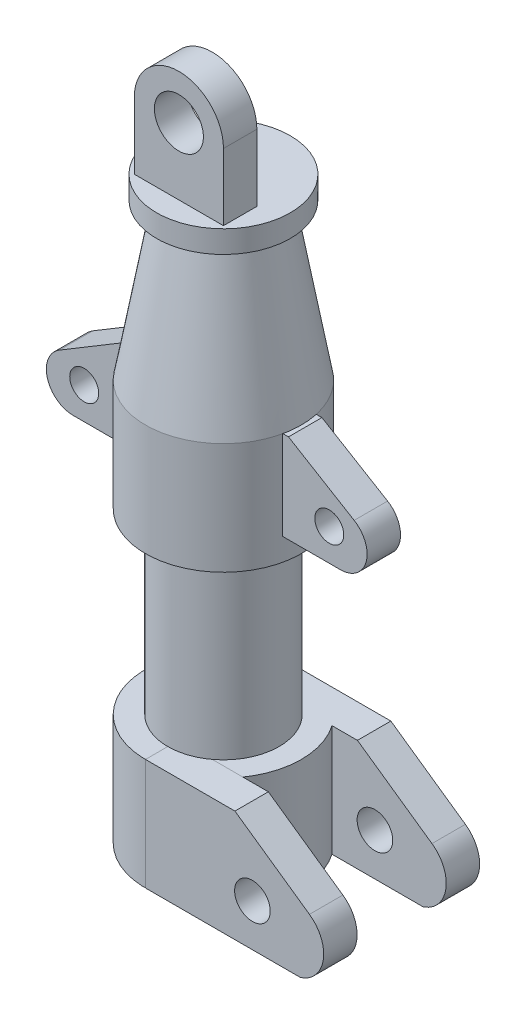
from build123d import *

# Parameters (mm, degrees)
SKETCH4_R             = 11
BOSS_EXTRUDE2_DEPTH   = 15
SKETCH5_R             = 6.5
BOSS_EXTRUDE3_DEPTH   = 7.5
BOSS_EXTRUDE3_2_DEPTH = 7.5
SKETCH8_R             = 8
BOSS_EXTRUDE4_DEPTH   = 15
SKETCH10_R            = 8
BOSS_EXTRUDE5_DEPTH   = 15
SKETCH11_R            = 20
CUT_EXTRUDE1_DEPTH    = 235


with BuildPart() as part:
    # Sketch3 → Revolve1 (revolve)
    with BuildSketch(Plane.XY, mode=Mode.PRIVATE) as revolve1_sk:
        Polygon((0, 260), (30, 260), (30, 250), (22.65711135, 250), (35, 180), (35, 130), (25, 130), (25, 50), (35, 50), (35, 0), (0, 0), align=None)
    revolve(revolve1_sk.sketch.rotate(Axis((0, 0, 0), (0, 1, 0)), 90), axis=Axis((0, 0, 0), (0, 1, 0)))

    # Sketch4 → Boss-Extrude2 (add)
    with BuildSketch(Plane.XY.offset(5)):
        with BuildLine():
            Line((-20, 260), (-20, 290))
            ThreePointArc((-20, 290), (0, 310), (20, 290))
            Line((20, 290), (20, 260))
            Line((20, 260), (-20, 260))
        make_face()
        with Locations((0, 290)):
            Circle(SKETCH4_R, mode=Mode.SUBTRACT)
    extrude(amount=BOSS_EXTRUDE2_DEPTH)

    # Sketch10 → Boss-Extrude5 (add)
    with BuildSketch(Plane.XY.offset(-35)):
        with BuildLine():
            Line((0, 0), (0, 50))
            Line((0, 50), (40.152536614, 50))
            Line((40.152536614, 50), (73.603646545, 26.577280664))
            add(Edge.make_bspline(
                [(73.603646545, 26.577280664), (75.127065021, 25.513502774), (76.980437774, 23.612432373), (78.731268766, 20.505635824), (79.726147072, 17.725211617), (80.11166501, 14.631092772), (79.807327508, 11.24718434), (78.882377726, 8.303748645), (77.361059944, 5.651175507), (74.672672088, 2.458032167), (71.81463949, 0.712940429), (69.560252186, 0)],
                knots=[0, 0, 0, 0, 0.167351003, 0.234881855, 0.320469705, 0.432120269, 0.512918946, 0.625495349, 0.707152757, 0.787292149, 1, 1, 1, 1], degree=3))
            Line((69.560252186, 0), (0, 0))
        make_face()
        with Locations((48, 19)):
            Circle(SKETCH10_R, mode=Mode.SUBTRACT)
    extrude(amount=BOSS_EXTRUDE5_DEPTH)

    # Sketch11 → Cut-Extrude1 (cut)
    with BuildSketch(Plane.XZ):
        with Locations(Location((0, 0, 0), (0, 0, 270))):
            Circle(SKETCH11_R)
    extrude(amount=-CUT_EXTRUDE1_DEPTH, mode=Mode.SUBTRACT)


with BuildPart() as body_2:
    # Sketch5 → Boss-Extrude3 (new, symmetric)
    with BuildSketch(Plane.XY):
        with BuildLine():
            Line((35, 180), (36.699422811, 180))
            Line((36.699422811, 180), (66.180456899, 162.286007608))
            ThreePointArc((66.180456899, 162.286007608), (71.563565439, 148.793139487), (60, 140))
            Line((60, 140), (35, 140))
            Line((35, 140), (32.771840792, 140))
            Line((32.771840792, 140), (32.771840792, 180))
            Line((32.771840792, 180), (35, 180))
        make_face()
        with Locations((55, 154.29)):
            Circle(SKETCH5_R, mode=Mode.SUBTRACT)
    extrude(amount=BOSS_EXTRUDE3_DEPTH, both=True)


with BuildPart() as body_3:
    # Sketch5 → Boss-Extrude3 2 (new, symmetric)
    with BuildSketch(Plane.XY):
        with BuildLine():
            Line((-60, 140), (-35, 140))
            Line((-35, 140), (-32.771840792, 140))
            Line((-32.771840792, 140), (-32.771840792, 180))
            Line((-32.771840792, 180), (-35, 180))
            Line((-35, 180), (-36.699422811, 180))
            Line((-36.699422811, 180), (-66.180456899, 162.286007608))
            ThreePointArc((-66.180456899, 162.286007608), (-71.563565439, 148.793139487), (-60, 140))
        make_face()
        with Locations(Location((-55, 154.29, 0), (0, 0, 180))):
            Circle(SKETCH5_R, mode=Mode.SUBTRACT)
    extrude(amount=BOSS_EXTRUDE3_2_DEPTH, both=True)


with BuildPart() as body_4:
    # Sketch8 → Boss-Extrude4 (new body)
    with BuildSketch(Plane.XY.offset(35)):
        with BuildLine():
            Line((35, 50), (40.152536614, 50))
            Line((40.152536614, 50), (73.603646545, 26.577280664))
            ThreePointArc((73.603646545, 26.577280664), (79.829363416, 12.033901449), (69.560252186, 0))
            Line((69.560252186, 0), (35, 0))
            Line((35, 0), (0, 0))
            Line((0, 0), (0, 50))
            Line((0, 50), (35, 50))
        make_face()
        with Locations((48, 19)):
            Circle(SKETCH8_R, mode=Mode.SUBTRACT)
    extrude(amount=-BOSS_EXTRUDE4_DEPTH)


solid = Compound([part.part, body_2.part, body_3.part, body_4.part])
